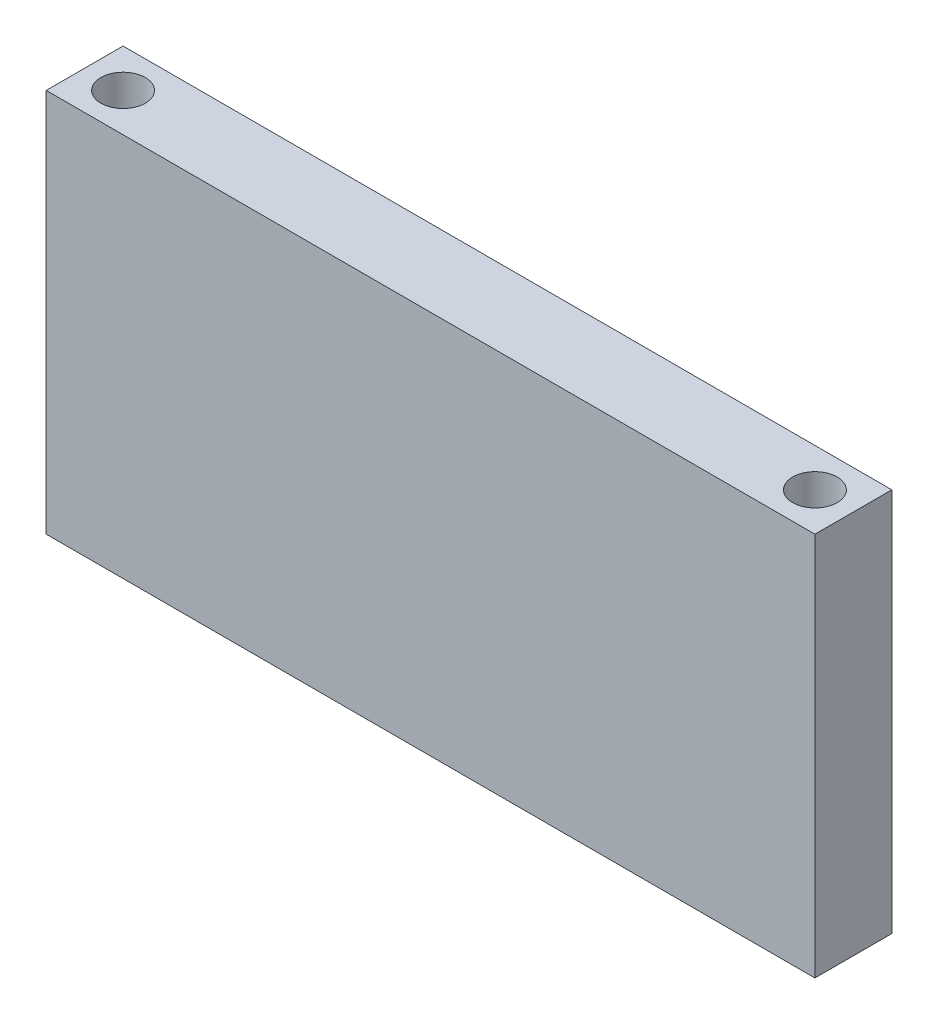
from build123d import *

# Parameters (mm, degrees)
SKETCH1_W                  = 100
SKETCH1_H                  = 10
BOSS_EXTRUDE1_DEPTH        = 50
F_1_0_228_DIAMETER_HOLE1_D = 5.7912


with BuildPart() as part:
    # Sketch1 → Boss-Extrude1 (new body)
    with BuildSketch(Plane(origin=(0, 0, 0), x_dir=(1, 0, 0), z_dir=(0, 1, 0))):
        with Locations((11.212121212, 5.757575758)):
            Rectangle(SKETCH1_W, SKETCH1_H)
    extrude(amount=BOSS_EXTRUDE1_DEPTH)

    # #1 (0.228) Diameter Hole1 (through all)
    with Locations(Plane(origin=(56.212121212, 0, -5.757575758), x_dir=(0, 0, -1), z_dir=(0, -1, 0))):
        with Locations((0, 0), (0, -90)):
            Hole(F_1_0_228_DIAMETER_HOLE1_D / 2)


solid = part.part
